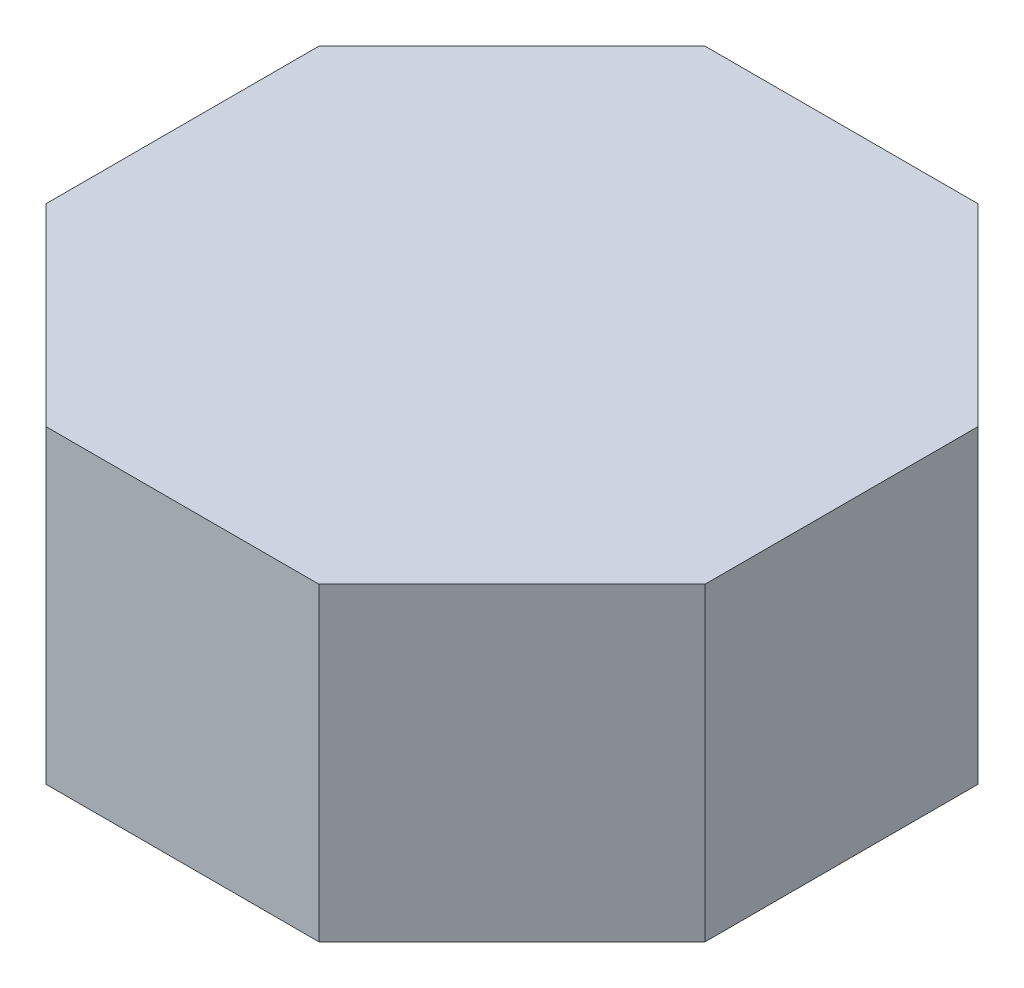
from build123d import *

# Parameters (mm, degrees)
EXTRUDE1_DEPTH = 1.88


with BuildPart() as part:
    # Sketch1 → Extrude1 (new body)
    with BuildSketch(Plane(origin=(0, 0, 0), x_dir=(1, 0, 0), z_dir=(0, 1, 0))):
        Polygon((-2, 0.828427125), (-0.828427125, 2), (0.828427125, 2), (2, 0.828427125), (2, -0.828427125), (0.828427125, -2), (-0.828427125, -2), (-2, -0.828427125), align=None)
    extrude(amount=EXTRUDE1_DEPTH)


solid = part.part
